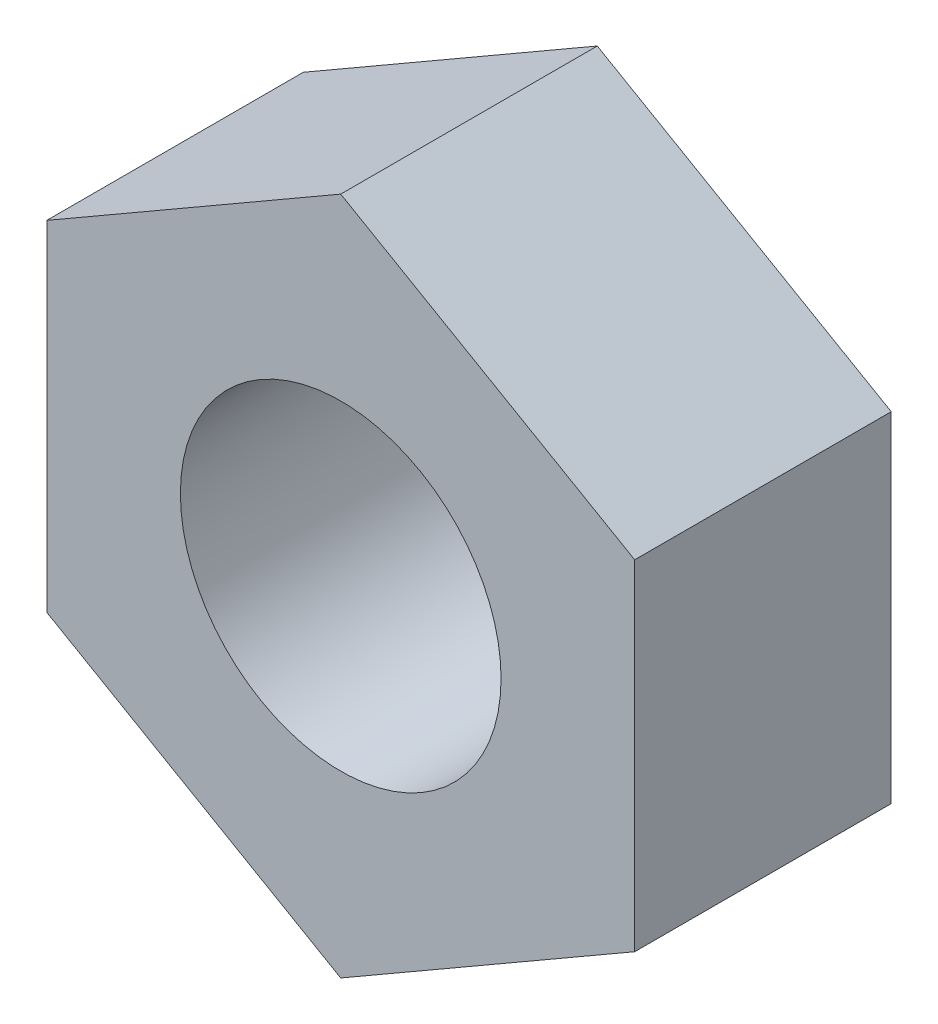
from build123d import *

# Parameters (mm, degrees)
SKETCH_1_R           = 1.5
NUT_SIMPLIFIED_DEPTH = 2.4


with BuildPart() as part:
    # 草图1 → Nut_simplified (new body)
    with BuildSketch(Plane.XY):
        Polygon((2.75, 1.58771324), (0, 3.175426481), (-2.75, 1.58771324), (-2.75, -1.58771324), (0, -3.175426481), (2.75, -1.58771324), align=None)
        Circle(SKETCH_1_R, mode=Mode.SUBTRACT)
    extrude(amount=NUT_SIMPLIFIED_DEPTH)


solid = part.part
